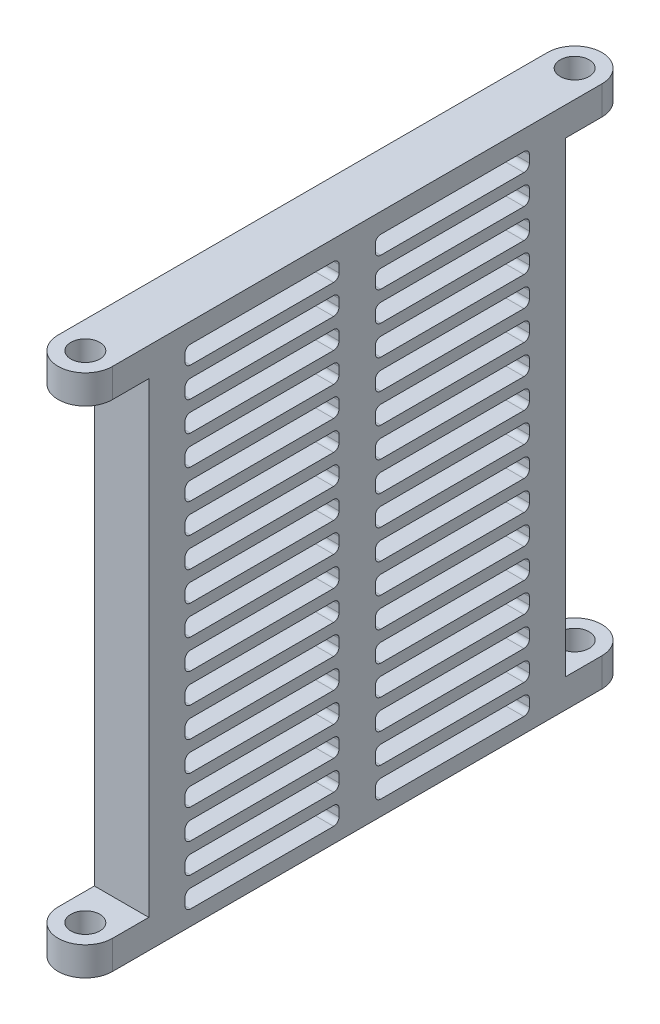
from build123d import *

# Parameters (mm, degrees)
SKETCH2_R           = 1.6
BOSS_EXTRUDE1_DEPTH = 3.175
SKETCH3_W           = 6
SKETCH3_H           = 46
BOSS_EXTRUDE2_DEPTH = 51.48
CUT_EXTRUDE1_DEPTH  = 82.42056804


with BuildPart() as part:
    # Sketch2 → Boss-Extrude1 (new body)
    with BuildSketch(Plane(origin=(0, 0, 0), x_dir=(1, 0, 0), z_dir=(0, 1, 0))):
        with BuildLine():
            Line((-3, 0), (-3, -54))
            ThreePointArc((-3, -54), (0, -57), (3, -54))
            Line((3, -54), (3, 0))
            ThreePointArc((3, 0), (0, 3), (-3, 0))
        make_face()
        with Locations(Location((0, 0, 0), (0, 0, 270))):
            Circle(SKETCH2_R, mode=Mode.SUBTRACT)
        with Locations(Location((0, -54, 0), (0, 0, 270))):
            Circle(SKETCH2_R, mode=Mode.SUBTRACT)
    boss_extrude1 = extrude(amount=BOSS_EXTRUDE1_DEPTH)

    # Sketch3 → Boss-Extrude2 (add)
    with BuildSketch(Plane(origin=(0, 3.175, 0), x_dir=(1, 0, 0), z_dir=(0, 1, 0))):
        with Locations((0, -27)):
            Rectangle(SKETCH3_W, SKETCH3_H)
    extrude(amount=BOSS_EXTRUDE2_DEPTH)

    # Mirror2: Boss-Extrude1 across plane
    add(boss_extrude1.mirror(Plane.ZX.offset(28.915)))

    # Sketch4 → Cut-Extrude1 (cut, through all)
    with BuildSketch(Plane(origin=(3, 0, 0), x_dir=(0, 0, -1), z_dir=(1, 0, 0))):
        with BuildLine():
            Line((-8.6, 13.42357141), (-24.4, 13.42357141))
            ThreePointArc((-24.4, 13.42357141), (-24.824264069, 13.247835479), (-25, 12.82357141))
            Line((-25, 12.82357141), (-25, 12.02357141))
            ThreePointArc((-25, 12.02357141), (-24.824264069, 11.599307341), (-24.4, 11.42357141))
            Line((-24.4, 11.42357141), (-8.6, 11.42357141))
            ThreePointArc((-8.6, 11.42357141), (-8.175735931, 11.599307341), (-8, 12.02357141))
            Line((-8, 12.02357141), (-8, 12.82357141))
            ThreePointArc((-8, 12.82357141), (-8.175735931, 13.247835479), (-8.6, 13.42357141))
        make_face()
        with BuildLine():
            Line((-8.6, 55.655), (-24.4, 55.655))
            ThreePointArc((-24.4, 55.655), (-24.824264069, 55.479264069), (-25, 55.055))
            Line((-25, 55.055), (-25, 54.255))
            ThreePointArc((-25, 54.255), (-24.824264069, 53.830735931), (-24.4, 53.655))
            Line((-24.4, 53.655), (-8.6, 53.655))
            ThreePointArc((-8.6, 53.655), (-8.175735931, 53.830735931), (-8, 54.255))
            Line((-8, 54.255), (-8, 55.055))
            ThreePointArc((-8, 55.055), (-8.175735931, 55.479264069), (-8.6, 55.655))
        make_face()
        with BuildLine():
            Line((-8.6, 52.40642857), (-24.4, 52.40642857))
            ThreePointArc((-24.4, 52.40642857), (-24.824264069, 52.230692639), (-25, 51.80642857))
            Line((-25, 51.80642857), (-25, 51.00642857))
            ThreePointArc((-25, 51.00642857), (-24.824264069, 50.582164501), (-24.4, 50.40642857))
            Line((-24.4, 50.40642857), (-8.6, 50.40642857))
            ThreePointArc((-8.6, 50.40642857), (-8.175735931, 50.582164501), (-8, 51.00642857))
            Line((-8, 51.00642857), (-8, 51.80642857))
            ThreePointArc((-8, 51.80642857), (-8.175735931, 52.230692639), (-8.6, 52.40642857))
        make_face()
        with BuildLine():
            Line((-8.6, 49.15785714), (-24.4, 49.15785714))
            ThreePointArc((-24.4, 49.15785714), (-24.824264069, 48.982121209), (-25, 48.55785714))
            Line((-25, 48.55785714), (-25, 47.75785714))
            ThreePointArc((-25, 47.75785714), (-24.824264069, 47.333593071), (-24.4, 47.15785714))
            Line((-24.4, 47.15785714), (-8.6, 47.15785714))
            ThreePointArc((-8.6, 47.15785714), (-8.175735931, 47.333593071), (-8, 47.75785714))
            Line((-8, 47.75785714), (-8, 48.55785714))
            ThreePointArc((-8, 48.55785714), (-8.175735931, 48.982121209), (-8.6, 49.15785714))
        make_face()
        with BuildLine():
            Line((-8.6, 45.90928571), (-24.4, 45.90928571))
            ThreePointArc((-24.4, 45.90928571), (-24.824264069, 45.733549779), (-25, 45.30928571))
            Line((-25, 45.30928571), (-25, 44.50928571))
            ThreePointArc((-25, 44.50928571), (-24.824264069, 44.085021641), (-24.4, 43.90928571))
            Line((-24.4, 43.90928571), (-8.6, 43.90928571))
            ThreePointArc((-8.6, 43.90928571), (-8.175735931, 44.085021641), (-8, 44.50928571))
            Line((-8, 44.50928571), (-8, 45.30928571))
            ThreePointArc((-8, 45.30928571), (-8.175735931, 45.733549779), (-8.6, 45.90928571))
        make_face()
        with BuildLine():
            Line((-8.6, 42.66071428), (-24.4, 42.66071428))
            ThreePointArc((-24.4, 42.66071428), (-24.824264069, 42.484978349), (-25, 42.06071428))
            Line((-25, 42.06071428), (-25, 41.26071428))
            ThreePointArc((-25, 41.26071428), (-24.824264069, 40.836450211), (-24.4, 40.66071428))
            Line((-24.4, 40.66071428), (-8.6, 40.66071428))
            ThreePointArc((-8.6, 40.66071428), (-8.175735931, 40.836450211), (-8, 41.26071428))
            Line((-8, 41.26071428), (-8, 42.06071428))
            ThreePointArc((-8, 42.06071428), (-8.175735931, 42.484978349), (-8.6, 42.66071428))
        make_face()
        with BuildLine():
            Line((-8.6, 39.41214285), (-24.4, 39.41214285))
            ThreePointArc((-24.4, 39.41214285), (-24.824264069, 39.236406919), (-25, 38.81214285))
            Line((-25, 38.81214285), (-25, 38.01214285))
            ThreePointArc((-25, 38.01214285), (-24.824264069, 37.587878781), (-24.4, 37.41214285))
            Line((-24.4, 37.41214285), (-8.6, 37.41214285))
            ThreePointArc((-8.6, 37.41214285), (-8.175735931, 37.587878781), (-8, 38.01214285))
            Line((-8, 38.01214285), (-8, 38.81214285))
            ThreePointArc((-8, 38.81214285), (-8.175735931, 39.236406919), (-8.6, 39.41214285))
        make_face()
        with BuildLine():
            Line((-8.6, 10.17499998), (-24.4, 10.17499998))
            ThreePointArc((-24.4, 10.17499998), (-24.824264069, 9.999264049), (-25, 9.57499998))
            Line((-25, 9.57499998), (-25, 8.77499998))
            ThreePointArc((-25, 8.77499998), (-24.824264069, 8.350735911), (-24.4, 8.17499998))
            Line((-24.4, 8.17499998), (-8.6, 8.17499998))
            ThreePointArc((-8.6, 8.17499998), (-8.175735931, 8.350735911), (-8, 8.77499998))
            Line((-8, 8.77499998), (-8, 9.57499998))
            ThreePointArc((-8, 9.57499998), (-8.175735931, 9.999264049), (-8.6, 10.17499998))
        make_face()
        with BuildLine():
            Line((-8.6, 36.16357142), (-24.4, 36.16357142))
            ThreePointArc((-24.4, 36.16357142), (-24.824264069, 35.987835489), (-25, 35.56357142))
            Line((-25, 35.56357142), (-25, 34.76357142))
            ThreePointArc((-25, 34.76357142), (-24.824264069, 34.339307351), (-24.4, 34.16357142))
            Line((-24.4, 34.16357142), (-8.6, 34.16357142))
            ThreePointArc((-8.6, 34.16357142), (-8.175735931, 34.339307351), (-8, 34.76357142))
            Line((-8, 34.76357142), (-8, 35.56357142))
            ThreePointArc((-8, 35.56357142), (-8.175735931, 35.987835489), (-8.6, 36.16357142))
        make_face()
        with BuildLine():
            Line((-8.6, 32.91499999), (-24.4, 32.91499999))
            ThreePointArc((-24.4, 32.91499999), (-24.824264069, 32.739264059), (-25, 32.31499999))
            Line((-25, 32.31499999), (-25, 31.51499999))
            ThreePointArc((-25, 31.51499999), (-24.824264069, 31.090735921), (-24.4, 30.91499999))
            Line((-24.4, 30.91499999), (-8.6, 30.91499999))
            ThreePointArc((-8.6, 30.91499999), (-8.175735931, 31.090735921), (-8, 31.51499999))
            Line((-8, 31.51499999), (-8, 32.31499999))
            ThreePointArc((-8, 32.31499999), (-8.175735931, 32.739264059), (-8.6, 32.91499999))
        make_face()
        with BuildLine():
            Line((-8.6, 29.66642856), (-24.4, 29.66642856))
            ThreePointArc((-24.4, 29.66642856), (-24.824264069, 29.490692629), (-25, 29.06642856))
            Line((-25, 29.06642856), (-25, 28.26642856))
            ThreePointArc((-25, 28.26642856), (-24.824264069, 27.842164491), (-24.4, 27.66642856))
            Line((-24.4, 27.66642856), (-8.6, 27.66642856))
            ThreePointArc((-8.6, 27.66642856), (-8.175735931, 27.842164491), (-8, 28.26642856))
            Line((-8, 28.26642856), (-8, 29.06642856))
            ThreePointArc((-8, 29.06642856), (-8.175735931, 29.490692629), (-8.6, 29.66642856))
        make_face()
        with BuildLine():
            Line((-8.6, 26.41785713), (-24.4, 26.41785713))
            ThreePointArc((-24.4, 26.41785713), (-24.824264069, 26.242121199), (-25, 25.81785713))
            Line((-25, 25.81785713), (-25, 25.01785713))
            ThreePointArc((-25, 25.01785713), (-24.824264069, 24.593593061), (-24.4, 24.41785713))
            Line((-24.4, 24.41785713), (-8.6, 24.41785713))
            ThreePointArc((-8.6, 24.41785713), (-8.175735931, 24.593593061), (-8, 25.01785713))
            Line((-8, 25.01785713), (-8, 25.81785713))
            ThreePointArc((-8, 25.81785713), (-8.175735931, 26.242121199), (-8.6, 26.41785713))
        make_face()
        with BuildLine():
            Line((-8.6, 23.1692857), (-24.4, 23.1692857))
            ThreePointArc((-24.4, 23.1692857), (-24.824264069, 22.993549769), (-25, 22.5692857))
            Line((-25, 22.5692857), (-25, 21.7692857))
            ThreePointArc((-25, 21.7692857), (-24.824264069, 21.345021631), (-24.4, 21.1692857))
            Line((-24.4, 21.1692857), (-8.6, 21.1692857))
            ThreePointArc((-8.6, 21.1692857), (-8.175735931, 21.345021631), (-8, 21.7692857))
            Line((-8, 21.7692857), (-8, 22.5692857))
            ThreePointArc((-8, 22.5692857), (-8.175735931, 22.993549769), (-8.6, 23.1692857))
        make_face()
        with BuildLine():
            Line((-8.6, 19.92071427), (-24.4, 19.92071427))
            ThreePointArc((-24.4, 19.92071427), (-24.824264069, 19.744978339), (-25, 19.32071427))
            Line((-25, 19.32071427), (-25, 18.52071427))
            ThreePointArc((-25, 18.52071427), (-24.824264069, 18.096450201), (-24.4, 17.92071427))
            Line((-24.4, 17.92071427), (-8.6, 17.92071427))
            ThreePointArc((-8.6, 17.92071427), (-8.175735931, 18.096450201), (-8, 18.52071427))
            Line((-8, 18.52071427), (-8, 19.32071427))
            ThreePointArc((-8, 19.32071427), (-8.175735931, 19.744978339), (-8.6, 19.92071427))
        make_face()
        with BuildLine():
            Line((-8.6, 16.67214284), (-24.4, 16.67214284))
            ThreePointArc((-24.4, 16.67214284), (-24.824264069, 16.496406909), (-25, 16.07214284))
            Line((-25, 16.07214284), (-25, 15.27214284))
            ThreePointArc((-25, 15.27214284), (-24.824264069, 14.847878771), (-24.4, 14.67214284))
            Line((-24.4, 14.67214284), (-8.6, 14.67214284))
            ThreePointArc((-8.6, 14.67214284), (-8.175735931, 14.847878771), (-8, 15.27214284))
            Line((-8, 15.27214284), (-8, 16.07214284))
            ThreePointArc((-8, 16.07214284), (-8.175735931, 16.496406909), (-8.6, 16.67214284))
        make_face()
        with BuildLine():
            Line((-8.6, 6.92642855), (-24.4, 6.92642855))
            ThreePointArc((-24.4, 6.92642855), (-24.824264069, 6.750692619), (-25, 6.32642855))
            Line((-25, 6.32642855), (-25, 5.52642855))
            ThreePointArc((-25, 5.52642855), (-24.824264069, 5.102164481), (-24.4, 4.92642855))
            Line((-24.4, 4.92642855), (-8.6, 4.92642855))
            ThreePointArc((-8.6, 4.92642855), (-8.175735931, 5.102164481), (-8, 5.52642855))
            Line((-8, 5.52642855), (-8, 6.32642855))
            ThreePointArc((-8, 6.32642855), (-8.175735931, 6.750692619), (-8.6, 6.92642855))
        make_face()
        with BuildLine():
            Line((-8.6, 3.67785712), (-24.4, 3.67785712))
            ThreePointArc((-24.4, 3.67785712), (-24.824264069, 3.502121189), (-25, 3.07785712))
            Line((-25, 3.07785712), (-25, 2.27785712))
            ThreePointArc((-25, 2.27785712), (-24.824264069, 1.853593051), (-24.4, 1.67785712))
            Line((-24.4, 1.67785712), (-8.6, 1.67785712))
            ThreePointArc((-8.6, 1.67785712), (-8.175735931, 1.853593051), (-8, 2.27785712))
            Line((-8, 2.27785712), (-8, 3.07785712))
            ThreePointArc((-8, 3.07785712), (-8.175735931, 3.502121189), (-8.6, 3.67785712))
        make_face()
        with BuildLine():
            Line((-29, 3.07785712), (-29, 2.27785712))
            ThreePointArc((-29, 2.27785712), (-29.175735931, 1.853593051), (-29.6, 1.67785712))
            Line((-29.6, 1.67785712), (-45.4, 1.67785712))
            ThreePointArc((-45.4, 1.67785712), (-45.824264069, 1.853593051), (-46, 2.27785712))
            Line((-46, 2.27785712), (-46, 3.07785712))
            ThreePointArc((-46, 3.07785712), (-45.824264069, 3.502121189), (-45.4, 3.67785712))
            Line((-45.4, 3.67785712), (-29.6, 3.67785712))
            ThreePointArc((-29.6, 3.67785712), (-29.175735931, 3.502121189), (-29, 3.07785712))
        make_face()
        with BuildLine():
            Line((-29, 6.32642855), (-29, 5.52642855))
            ThreePointArc((-29, 5.52642855), (-29.175735931, 5.102164481), (-29.6, 4.92642855))
            Line((-29.6, 4.92642855), (-45.4, 4.92642855))
            ThreePointArc((-45.4, 4.92642855), (-45.824264069, 5.102164481), (-46, 5.52642855))
            Line((-46, 5.52642855), (-46, 6.32642855))
            ThreePointArc((-46, 6.32642855), (-45.824264069, 6.750692619), (-45.4, 6.92642855))
            Line((-45.4, 6.92642855), (-29.6, 6.92642855))
            ThreePointArc((-29.6, 6.92642855), (-29.175735931, 6.750692619), (-29, 6.32642855))
        make_face()
        with BuildLine():
            Line((-29, 16.07214284), (-29, 15.27214284))
            ThreePointArc((-29, 15.27214284), (-29.175735931, 14.847878771), (-29.6, 14.67214284))
            Line((-29.6, 14.67214284), (-45.4, 14.67214284))
            ThreePointArc((-45.4, 14.67214284), (-45.824264069, 14.847878771), (-46, 15.27214284))
            Line((-46, 15.27214284), (-46, 16.07214284))
            ThreePointArc((-46, 16.07214284), (-45.824264069, 16.496406909), (-45.4, 16.67214284))
            Line((-45.4, 16.67214284), (-29.6, 16.67214284))
            ThreePointArc((-29.6, 16.67214284), (-29.175735931, 16.496406909), (-29, 16.07214284))
        make_face()
        with BuildLine():
            Line((-29, 19.32071427), (-29, 18.52071427))
            ThreePointArc((-29, 18.52071427), (-29.175735931, 18.096450201), (-29.6, 17.92071427))
            Line((-29.6, 17.92071427), (-45.4, 17.92071427))
            ThreePointArc((-45.4, 17.92071427), (-45.824264069, 18.096450201), (-46, 18.52071427))
            Line((-46, 18.52071427), (-46, 19.32071427))
            ThreePointArc((-46, 19.32071427), (-45.824264069, 19.744978339), (-45.4, 19.92071427))
            Line((-45.4, 19.92071427), (-29.6, 19.92071427))
            ThreePointArc((-29.6, 19.92071427), (-29.175735931, 19.744978339), (-29, 19.32071427))
        make_face()
        with BuildLine():
            Line((-29, 22.5692857), (-29, 21.7692857))
            ThreePointArc((-29, 21.7692857), (-29.175735931, 21.345021631), (-29.6, 21.1692857))
            Line((-29.6, 21.1692857), (-45.4, 21.1692857))
            ThreePointArc((-45.4, 21.1692857), (-45.824264069, 21.345021631), (-46, 21.7692857))
            Line((-46, 21.7692857), (-46, 22.5692857))
            ThreePointArc((-46, 22.5692857), (-45.824264069, 22.993549769), (-45.4, 23.1692857))
            Line((-45.4, 23.1692857), (-29.6, 23.1692857))
            ThreePointArc((-29.6, 23.1692857), (-29.175735931, 22.993549769), (-29, 22.5692857))
        make_face()
        with BuildLine():
            Line((-29, 25.81785713), (-29, 25.01785713))
            ThreePointArc((-29, 25.01785713), (-29.175735931, 24.593593061), (-29.6, 24.41785713))
            Line((-29.6, 24.41785713), (-45.4, 24.41785713))
            ThreePointArc((-45.4, 24.41785713), (-45.824264069, 24.593593061), (-46, 25.01785713))
            Line((-46, 25.01785713), (-46, 25.81785713))
            ThreePointArc((-46, 25.81785713), (-45.824264069, 26.242121199), (-45.4, 26.41785713))
            Line((-45.4, 26.41785713), (-29.6, 26.41785713))
            ThreePointArc((-29.6, 26.41785713), (-29.175735931, 26.242121199), (-29, 25.81785713))
        make_face()
        with BuildLine():
            Line((-29, 29.06642856), (-29, 28.26642856))
            ThreePointArc((-29, 28.26642856), (-29.175735931, 27.842164491), (-29.6, 27.66642856))
            Line((-29.6, 27.66642856), (-45.4, 27.66642856))
            ThreePointArc((-45.4, 27.66642856), (-45.824264069, 27.842164491), (-46, 28.26642856))
            Line((-46, 28.26642856), (-46, 29.06642856))
            ThreePointArc((-46, 29.06642856), (-45.824264069, 29.490692629), (-45.4, 29.66642856))
            Line((-45.4, 29.66642856), (-29.6, 29.66642856))
            ThreePointArc((-29.6, 29.66642856), (-29.175735931, 29.490692629), (-29, 29.06642856))
        make_face()
        with BuildLine():
            Line((-29, 32.31499999), (-29, 31.51499999))
            ThreePointArc((-29, 31.51499999), (-29.175735931, 31.090735921), (-29.6, 30.91499999))
            Line((-29.6, 30.91499999), (-45.4, 30.91499999))
            ThreePointArc((-45.4, 30.91499999), (-45.824264069, 31.090735921), (-46, 31.51499999))
            Line((-46, 31.51499999), (-46, 32.31499999))
            ThreePointArc((-46, 32.31499999), (-45.824264069, 32.739264059), (-45.4, 32.91499999))
            Line((-45.4, 32.91499999), (-29.6, 32.91499999))
            ThreePointArc((-29.6, 32.91499999), (-29.175735931, 32.739264059), (-29, 32.31499999))
        make_face()
        with BuildLine():
            Line((-29, 35.56357142), (-29, 34.76357142))
            ThreePointArc((-29, 34.76357142), (-29.175735931, 34.339307351), (-29.6, 34.16357142))
            Line((-29.6, 34.16357142), (-45.4, 34.16357142))
            ThreePointArc((-45.4, 34.16357142), (-45.824264069, 34.339307351), (-46, 34.76357142))
            Line((-46, 34.76357142), (-46, 35.56357142))
            ThreePointArc((-46, 35.56357142), (-45.824264069, 35.987835489), (-45.4, 36.16357142))
            Line((-45.4, 36.16357142), (-29.6, 36.16357142))
            ThreePointArc((-29.6, 36.16357142), (-29.175735931, 35.987835489), (-29, 35.56357142))
        make_face()
        with BuildLine():
            Line((-29, 38.81214285), (-29, 38.01214285))
            ThreePointArc((-29, 38.01214285), (-29.175735931, 37.587878781), (-29.6, 37.41214285))
            Line((-29.6, 37.41214285), (-45.4, 37.41214285))
            ThreePointArc((-45.4, 37.41214285), (-45.824264069, 37.587878781), (-46, 38.01214285))
            Line((-46, 38.01214285), (-46, 38.81214285))
            ThreePointArc((-46, 38.81214285), (-45.824264069, 39.236406919), (-45.4, 39.41214285))
            Line((-45.4, 39.41214285), (-29.6, 39.41214285))
            ThreePointArc((-29.6, 39.41214285), (-29.175735931, 39.236406919), (-29, 38.81214285))
        make_face()
        with BuildLine():
            Line((-29, 9.57499998), (-29, 8.77499998))
            ThreePointArc((-29, 8.77499998), (-29.175735931, 8.350735911), (-29.6, 8.17499998))
            Line((-29.6, 8.17499998), (-45.4, 8.17499998))
            ThreePointArc((-45.4, 8.17499998), (-45.824264069, 8.350735911), (-46, 8.77499998))
            Line((-46, 8.77499998), (-46, 9.57499998))
            ThreePointArc((-46, 9.57499998), (-45.824264069, 9.999264049), (-45.4, 10.17499998))
            Line((-45.4, 10.17499998), (-29.6, 10.17499998))
            ThreePointArc((-29.6, 10.17499998), (-29.175735931, 9.999264049), (-29, 9.57499998))
        make_face()
        with BuildLine():
            Line((-29, 42.06071428), (-29, 41.26071428))
            ThreePointArc((-29, 41.26071428), (-29.175735931, 40.836450211), (-29.6, 40.66071428))
            Line((-29.6, 40.66071428), (-45.4, 40.66071428))
            ThreePointArc((-45.4, 40.66071428), (-45.824264069, 40.836450211), (-46, 41.26071428))
            Line((-46, 41.26071428), (-46, 42.06071428))
            ThreePointArc((-46, 42.06071428), (-45.824264069, 42.484978349), (-45.4, 42.66071428))
            Line((-45.4, 42.66071428), (-29.6, 42.66071428))
            ThreePointArc((-29.6, 42.66071428), (-29.175735931, 42.484978349), (-29, 42.06071428))
        make_face()
        with BuildLine():
            Line((-29, 45.30928571), (-29, 44.50928571))
            ThreePointArc((-29, 44.50928571), (-29.175735931, 44.085021641), (-29.6, 43.90928571))
            Line((-29.6, 43.90928571), (-45.4, 43.90928571))
            ThreePointArc((-45.4, 43.90928571), (-45.824264069, 44.085021641), (-46, 44.50928571))
            Line((-46, 44.50928571), (-46, 45.30928571))
            ThreePointArc((-46, 45.30928571), (-45.824264069, 45.733549779), (-45.4, 45.90928571))
            Line((-45.4, 45.90928571), (-29.6, 45.90928571))
            ThreePointArc((-29.6, 45.90928571), (-29.175735931, 45.733549779), (-29, 45.30928571))
        make_face()
        with BuildLine():
            Line((-29, 48.55785714), (-29, 47.75785714))
            ThreePointArc((-29, 47.75785714), (-29.175735931, 47.333593071), (-29.6, 47.15785714))
            Line((-29.6, 47.15785714), (-45.4, 47.15785714))
            ThreePointArc((-45.4, 47.15785714), (-45.824264069, 47.333593071), (-46, 47.75785714))
            Line((-46, 47.75785714), (-46, 48.55785714))
            ThreePointArc((-46, 48.55785714), (-45.824264069, 48.982121209), (-45.4, 49.15785714))
            Line((-45.4, 49.15785714), (-29.6, 49.15785714))
            ThreePointArc((-29.6, 49.15785714), (-29.175735931, 48.982121209), (-29, 48.55785714))
        make_face()
        with BuildLine():
            Line((-29, 51.80642857), (-29, 51.00642857))
            ThreePointArc((-29, 51.00642857), (-29.175735931, 50.582164501), (-29.6, 50.40642857))
            Line((-29.6, 50.40642857), (-45.4, 50.40642857))
            ThreePointArc((-45.4, 50.40642857), (-45.824264069, 50.582164501), (-46, 51.00642857))
            Line((-46, 51.00642857), (-46, 51.80642857))
            ThreePointArc((-46, 51.80642857), (-45.824264069, 52.230692639), (-45.4, 52.40642857))
            Line((-45.4, 52.40642857), (-29.6, 52.40642857))
            ThreePointArc((-29.6, 52.40642857), (-29.175735931, 52.230692639), (-29, 51.80642857))
        make_face()
        with BuildLine():
            Line((-29, 55.055), (-29, 54.255))
            ThreePointArc((-29, 54.255), (-29.175735931, 53.830735931), (-29.6, 53.655))
            Line((-29.6, 53.655), (-45.4, 53.655))
            ThreePointArc((-45.4, 53.655), (-45.824264069, 53.830735931), (-46, 54.255))
            Line((-46, 54.255), (-46, 55.055))
            ThreePointArc((-46, 55.055), (-45.824264069, 55.479264069), (-45.4, 55.655))
            Line((-45.4, 55.655), (-29.6, 55.655))
            ThreePointArc((-29.6, 55.655), (-29.175735931, 55.479264069), (-29, 55.055))
        make_face()
        with BuildLine():
            Line((-29, 12.82357141), (-29, 12.02357141))
            ThreePointArc((-29, 12.02357141), (-29.175735931, 11.599307341), (-29.6, 11.42357141))
            Line((-29.6, 11.42357141), (-45.4, 11.42357141))
            ThreePointArc((-45.4, 11.42357141), (-45.824264069, 11.599307341), (-46, 12.02357141))
            Line((-46, 12.02357141), (-46, 12.82357141))
            ThreePointArc((-46, 12.82357141), (-45.824264069, 13.247835479), (-45.4, 13.42357141))
            Line((-45.4, 13.42357141), (-29.6, 13.42357141))
            ThreePointArc((-29.6, 13.42357141), (-29.175735931, 13.247835479), (-29, 12.82357141))
        make_face()
    extrude(amount=-CUT_EXTRUDE1_DEPTH, mode=Mode.SUBTRACT)


solid = part.part
